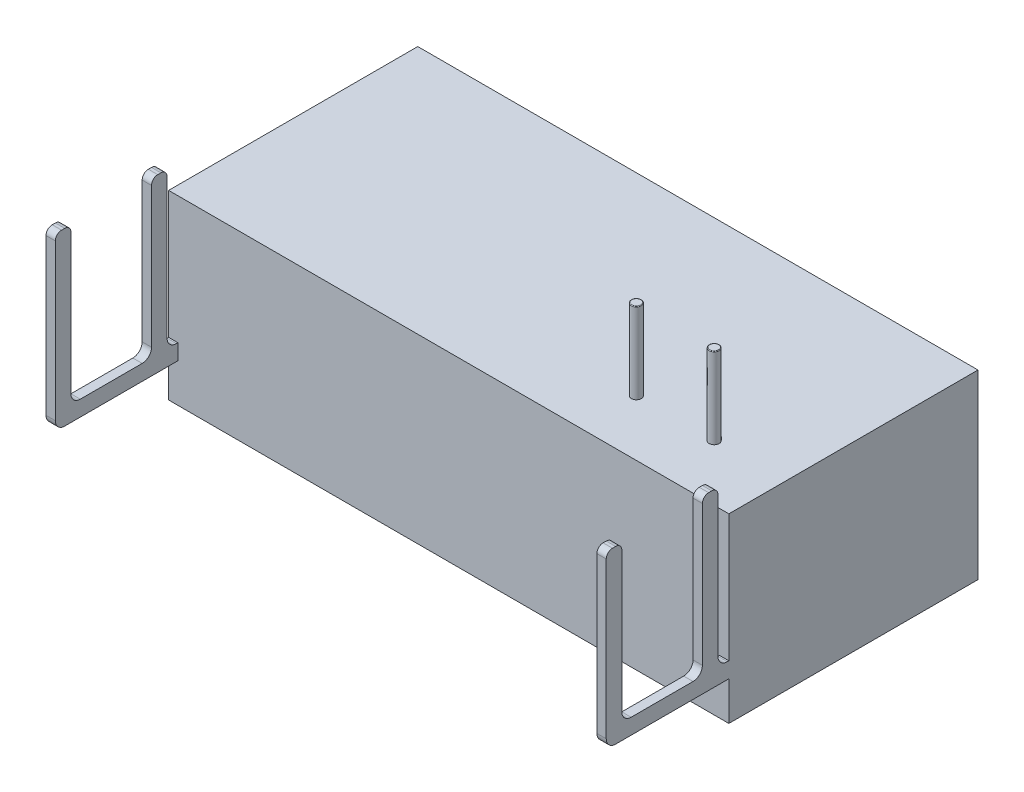
from build123d import *

# Parameters (mm, degrees)
SKETCH1_W           = 800
SKETCH1_H           = 583
BOSS_EXTRUDE1_DEPTH = 1798.93
SKETCH2_R           = 16
BOSS_EXTRUDE2_DEPTH = 260
LPATTERN1_COUNT     = 2
LPATTERN1_PITCH     = 250
BOSS_EXTRUDE4_DEPTH = 30
LPATTERN3_COUNT     = 2
LPATTERN3_PITCH     = 1768.93
FILLET1_R           = 2


with BuildPart() as part:
    # Sketch1 → Boss-Extrude1 (new body)
    with BuildSketch(Plane(origin=(0, 0, 0), x_dir=(0, 0, -1), z_dir=(1, 0, 0))):
        with Locations((400, 291.5)):
            Rectangle(SKETCH1_W, SKETCH1_H)
    extrude(amount=BOSS_EXTRUDE1_DEPTH)

    # Sketch2 → Boss-Extrude2 (add)
    with BuildSketch(Plane(origin=(0, 583, 0), x_dir=(1, 0, 0), z_dir=(0, 1, 0))):
        with Locations(Location((1572.09, 179.8, 0), (0, 0, 90))):
            Circle(SKETCH2_R)
    boss_extrude2 = extrude(amount=BOSS_EXTRUDE2_DEPTH)

    # LPattern1: Boss-Extrude2 ×2
    with Locations(*[(-i * LPATTERN1_PITCH, 0, 0) for i in range(1, LPATTERN1_COUNT)]):
        add(boss_extrude2)

    # Sketch3 → Boss-Extrude4 (add)
    with BuildSketch(Plane.ZY):
        with BuildLine():
            Line((0, 174.272998957), (5, 174.272998957))
            ThreePointArc((5, 174.272998957), (26.213203436, 183.059795522), (35, 204.272998957))
            Line((35, 204.272998957), (35, 654.272998957))
            ThreePointArc((35, 654.272998957), (40.857864376, 668.415134581), (55, 674.272998957))
            Line((55, 674.272998957), (65, 674.272998957))
            ThreePointArc((65, 674.272998957), (79.142135624, 668.415134581), (85, 654.272998957))
            Line((85, 654.272998957), (85, 204.272998957))
            ThreePointArc((85, 204.272998957), (93.786796564, 183.059795522), (115, 174.272998957))
            Line((115, 174.272998957), (313.77, 174.272998957))
            ThreePointArc((313.77, 174.272998957), (334.983203436, 183.059795522), (343.77, 204.272998957))
            Line((343.77, 204.272998957), (343.77, 654.272998957))
            ThreePointArc((343.77, 654.272998957), (349.627864376, 668.415134581), (363.77, 674.272998957))
            Line((363.77, 674.272998957), (373.77, 674.272998957))
            ThreePointArc((373.77, 674.272998957), (387.912135624, 668.415134581), (393.77, 654.272998957))
            Line((393.77, 654.272998957), (393.77, 154.272998957))
            ThreePointArc((393.77, 154.272998957), (384.983203436, 133.059795522), (363.77, 124.272998957))
            Line((363.77, 124.272998957), (0, 124.272998957))
            Line((0, 124.272998957), (0, 174.272998957))
        make_face()
    boss_extrude4 = extrude(amount=-BOSS_EXTRUDE4_DEPTH)

    # LPattern3: Boss-Extrude4 ×2
    with Locations(*[(i * LPATTERN3_PITCH, 0, 0) for i in range(1, LPATTERN3_COUNT)]):
        add(boss_extrude4)

    # Fillet1
    fillet1_edges = [part.edges().sort_by_distance(p)[0] for p in [
        (1572.09, 843, -163.8),
        (1322.09, 843, -163.8),
    ]]
    fillet(fillet1_edges, radius=FILLET1_R)


solid = part.part
